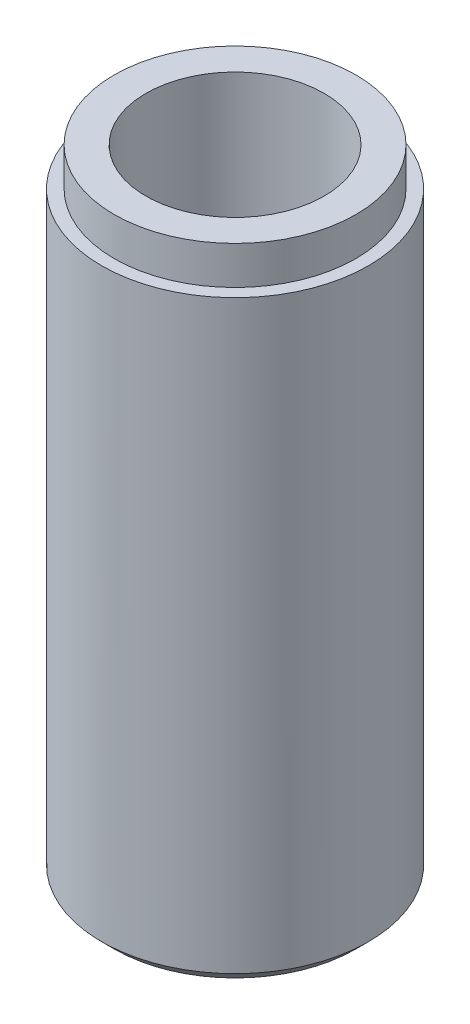
from build123d import *

# Parameters (mm, degrees)
SKETCH_1_W          = 3.4775
SKETCH_1_H          = 50
CHAMFER_1_SIZE      = 1
SKETCH_2_OUTSIDE_W  = 34.58
SKETCH_2_OUTSIDE_H  = 34.58
SKETCH_2_OUTSIDE_R  = 9.5
CUT_EXTRUDE_1_DEPTH = 3


with BuildPart() as part:
    # Эскиз1 → Повернуть1 (revolve)
    with BuildSketch(Plane.XY, mode=Mode.PRIVATE) as revolve_1_sk:
        with Locations((8.73875, 25)):
            Rectangle(SKETCH_1_W, SKETCH_1_H)
    revolve(revolve_1_sk.sketch.rotate(Axis((0, 0, 0), (0, 1, 0)), 90), axis=Axis((0, 0, 0), (0, 1, 0)))

    # Фаска1
    chamfer_1_edges = [part.edges().sort_by_distance(p)[0] for p in [
        (0, 0, 10.4775),
    ]]
    chamfer(chamfer_1_edges, length=CHAMFER_1_SIZE)

    # Эскиз2 outside → Вытянуть1 (cut)
    with BuildSketch(Plane(origin=(0, 50, 0), x_dir=(1, 0, 0), z_dir=(0, 1, 0))):
        Rectangle(SKETCH_2_OUTSIDE_W, SKETCH_2_OUTSIDE_H)
        with Locations(Location((0, 0, 0), (0, 0, 270))):
            Circle(SKETCH_2_OUTSIDE_R, mode=Mode.SUBTRACT)
    extrude(amount=-CUT_EXTRUDE_1_DEPTH, mode=Mode.SUBTRACT)


solid = part.part
